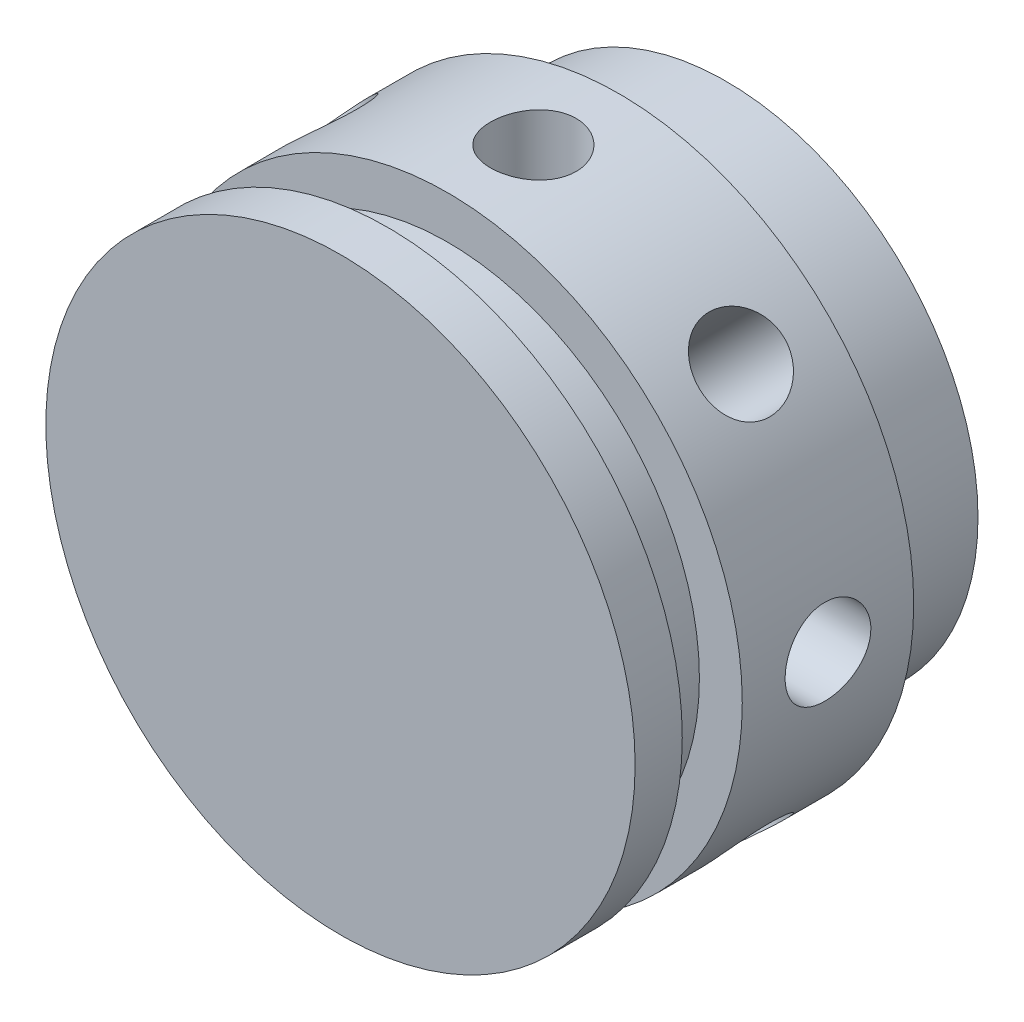
from build123d import *

# Parameters (mm, degrees)
ESBO_O3_R             = 2
CORTE_EXTRUS_O1_DEPTH = 8
PADR_OCIRCULAR1_COUNT = 8
ESBO_O4_R             = 2
CORTE_EXTRUS_O2_DEPTH = 5


with BuildPart() as part:
    # Esboço2 → Revolução1 (revolve)
    with BuildSketch(Plane(origin=(0, 0, 0), x_dir=(1, 0, 0), z_dir=(0, 1, 0)), mode=Mode.PRIVATE) as revolu_o1_sk:
        Polygon((0, 0), (-13.75, 0), (-13.75, 2.2), (-11.75, 2.2), (-11.75, 5), (-13.75, 5), (-13.75, 13), (-11.75, 13), (-11.75, 18), (0, 18), align=None)
    revolve(revolu_o1_sk.sketch.rotate(Axis((0, 0, 0), (0, 0, -1)), 180), axis=Axis((0, 0, 0), (0, 0, -1)))

    # Esboço3 → Corte-extrusão1 (cut)
    with BuildSketch(Plane(origin=(0, 13.75, 0), x_dir=(1, 0, 0), z_dir=(0, 1, 0))):
        with Locations(Location((0, 9, 0), (0, 0, 270))):
            Circle(ESBO_O3_R)
    corte_extrus_o1 = extrude(amount=-CORTE_EXTRUS_O1_DEPTH, mode=Mode.SUBTRACT)

    # PadrãoCircular1: Corte-extrusão1 ×8 about axis
    padr_ocircular1_axis = Axis((0, 0, 0), (0, 0, 1))
    for i in range(1, PADR_OCIRCULAR1_COUNT):
        add(corte_extrus_o1.rotate(padr_ocircular1_axis, i * 360 / PADR_OCIRCULAR1_COUNT), mode=Mode.SUBTRACT)

    # Esboço4 → Corte-extrusão2 (cut)
    with BuildSketch(Plane(origin=(0, 0, -18), x_dir=(-1, 0, 0), z_dir=(0, 0, -1))):
        Circle(ESBO_O4_R)
    extrude(amount=-CORTE_EXTRUS_O2_DEPTH, mode=Mode.SUBTRACT)


solid = part.part
